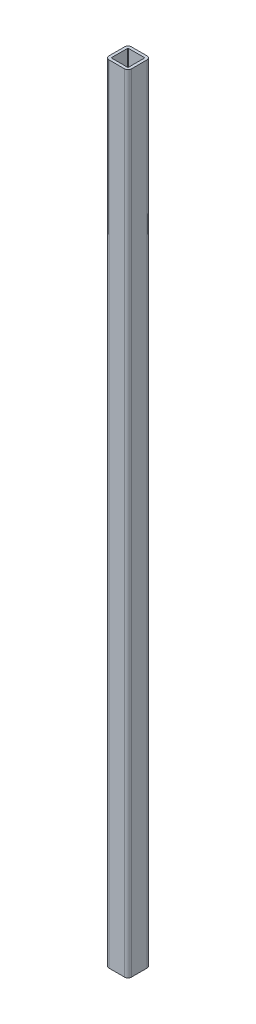
from build123d import *

# Parameters (mm, degrees)
BOSS_EXTRUDE1_DEPTH = 1778


with BuildPart() as part:
    # Sketch2 → Boss-Extrude1 (new body)
    with BuildSketch(Plane(origin=(0, 0, 0), x_dir=(1, 0, 0), z_dir=(0, 1, 0))):
        with BuildLine():
            Line((-17.78, -25.4), (17.78, -25.4))
            ThreePointArc((17.78, -25.4), (23.168153673, -23.168153673), (25.4, -17.78))
            Line((25.4, -17.78), (25.4, 17.78))
            ThreePointArc((25.4, 17.78), (23.168153673, 23.168153673), (17.78, 25.4))
            Line((17.78, 25.4), (-17.78, 25.4))
            ThreePointArc((-17.78, 25.4), (-23.168153673, 23.168153673), (-25.4, 17.78))
            Line((-25.4, 17.78), (-25.4, -17.78))
            ThreePointArc((-25.4, -17.78), (-23.168153673, -23.168153673), (-17.78, -25.4))
        make_face()
        with BuildLine():
            Line((-17.78, -19.05), (17.78, -19.05))
            ThreePointArc((17.78, -19.05), (18.678025612, -18.678025612), (19.05, -17.78))
            Line((19.05, -17.78), (19.05, 17.78))
            ThreePointArc((19.05, 17.78), (18.678025612, 18.678025612), (17.78, 19.05))
            Line((17.78, 19.05), (-17.78, 19.05))
            ThreePointArc((-17.78, 19.05), (-18.678025612, 18.678025612), (-19.05, 17.78))
            Line((-19.05, 17.78), (-19.05, -17.78))
            ThreePointArc((-19.05, -17.78), (-18.678025612, -18.678025612), (-17.78, -19.05))
        make_face(mode=Mode.SUBTRACT)
    extrude(amount=BOSS_EXTRUDE1_DEPTH)


solid = part.part
